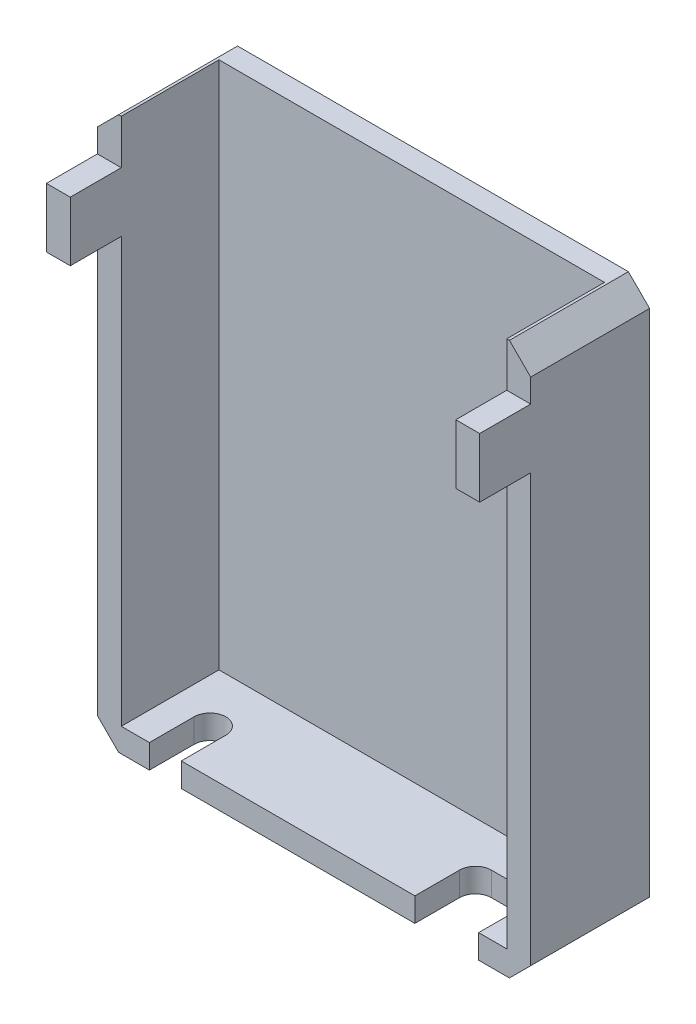
from build123d import *

# Parameters (mm, degrees)
SKETCH11_W          = 20.4
SKETCH11_H          = 26
BOSS_EXTRUDE5_DEPTH = 1
BOSS_EXTRUDE6_DEPTH = 4.6
CHAMFER2_SIZE       = 1
CUT_EXTRUDE1_REACH  = 30.485
SKETCH14_W          = 1.125
SKETCH14_H          = 2.8
BOSS_EXTRUDE7_DEPTH = 2.4


with BuildPart() as part:
    # Sketch11 → Boss-Extrude5 (new body)
    with BuildSketch(Plane.XY):
        Rectangle(SKETCH11_W, SKETCH11_H)
    extrude(amount=BOSS_EXTRUDE5_DEPTH)

    # Sketch12 → Boss-Extrude6 (add)
    with BuildSketch(Plane.XY.offset(1)):
        Polygon((-10.2, 13), (-10.2, -13), (10.2, -13), (10.2, 13), (9.075, 13), (9.075, -11.875), (-9.075, -11.875), (-9.075, 13), align=None)
    extrude(amount=BOSS_EXTRUDE6_DEPTH)

    # Chamfer2
    chamfer2_edges = [part.edges().sort_by_distance(p)[0] for p in [
        (-10.2, 13, 2.8),
        (10.2, 13, 2.8),
        (10.2, -13, 2.8),
        (-10.2, -13, 2.8),
    ]]
    chamfer(chamfer2_edges, length=CHAMFER2_SIZE)

    # Sketch13 → Cut-Extrude1 (cut, up to next)
    with BuildSketch(Plane.XZ.offset(13), mode=Mode.PRIVATE) as cut_extrude1_sk1:
        with BuildLine():
            Line((-7.75, 5.6), (-6.25, 5.6))
            Line((-6.25, 5.6), (-6.25, 3.5))
            ThreePointArc((-6.25, 3.5), (-7, 2.75), (-7.75, 3.5))
            Line((-7.75, 3.5), (-7.75, 5.6))
        make_face()
    cut_extrude1_tool1 = extrude(cut_extrude1_sk1.sketch, amount=-CUT_EXTRUDE1_REACH, mode=Mode.PRIVATE) & part.part
    # Sketch13 → Cut-Extrude1 (cut, up to next)
    with BuildSketch(Plane.XZ.offset(13), mode=Mode.PRIVATE) as cut_extrude1_sk2:
        with BuildLine():
            Line((7.75, 5.6), (4.75, 5.6))
            Line((4.75, 5.6), (4.75, 3.5))
            ThreePointArc((4.75, 3.5), (4.969669914, 2.969669914), (5.5, 2.75))
            Line((5.5, 2.75), (7, 2.75))
            ThreePointArc((7, 2.75), (7.530330086, 2.969669914), (7.75, 3.5))
            Line((7.75, 3.5), (7.75, 5.6))
        make_face()
    cut_extrude1_tool2 = extrude(cut_extrude1_sk2.sketch, amount=-CUT_EXTRUDE1_REACH, mode=Mode.PRIVATE) & part.part
    add(cut_extrude1_tool1.solids().sort_by_distance((-7, -13, 4.250265))[0], mode=Mode.SUBTRACT)
    add(cut_extrude1_tool2.solids().sort_by_distance((6.25, -13, 4.211539))[0], mode=Mode.SUBTRACT)

    # Sketch14 → Boss-Extrude7 (add)
    with BuildSketch(Plane.XY.offset(5.6)):
        with Locations((-9.6375, 9.5)):
            Rectangle(SKETCH14_W, SKETCH14_H)
        with Locations((9.6375, 9.5)):
            Rectangle(SKETCH14_W, SKETCH14_H)
    extrude(amount=BOSS_EXTRUDE7_DEPTH)


solid = part.part
